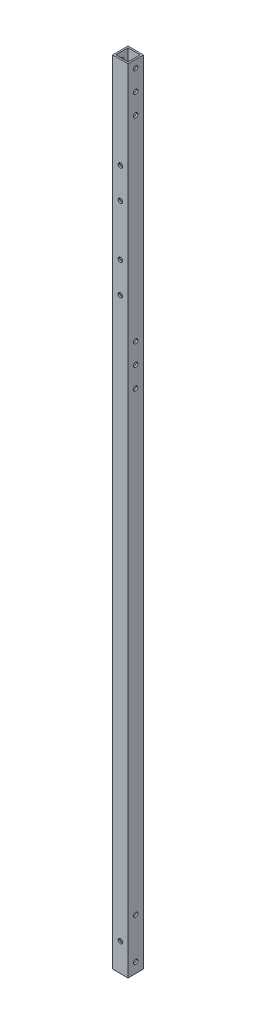
from build123d import *

# Parameters (mm, degrees)
SKETCH_1_W          = 15
SKETCH_1_H          = 15
SKETCH_1_W_2        = 12
SKETCH_1_H_2        = 12
EXTRUDE_1_DEPTH     = 775
CUT_EXTRUDE_1_REACH = 777.29
SKETCH_2_R          = 2.15
CUT_EXTRUDE_2_REACH = 777.29
SKETCH_3_R          = 2.15


with BuildPart() as part:
    # ｽｹｯﾁ1 → 押し出し-薄板1 (new body)
    with BuildSketch(Plane(origin=(0, 0, 0), x_dir=(1, 0, 0), z_dir=(0, 1, 0))):
        with Locations((7.5, 7.5)):
            Rectangle(SKETCH_1_W, SKETCH_1_H)
        with Locations((7.5, 7.5)):
            Rectangle(SKETCH_1_W_2, SKETCH_1_H_2, mode=Mode.SUBTRACT)
    extrude(amount=EXTRUDE_1_DEPTH)

    # ｶｯﾄ - 押し出し1: up to this face of the body (flat: up to its plane)
    cut_extrude_1_end = Plane(part.part.faces().sort_by_distance((0, 387.5, -7.5))[0])
    # ｽｹｯﾁ2 → ｶｯﾄ - 押し出し1 (cut, up to the picked face)
    with BuildSketch(Plane(origin=(15, 0, 0), x_dir=(0, 0, -1), z_dir=(1, 0, 0)), mode=Mode.PRIVATE) as cut_extrude_1_sk1:
        with Locations((7.5, 10)):
            Circle(SKETCH_2_R)
    cut_extrude_1_tool1 = split(extrude(cut_extrude_1_sk1.sketch, amount=-CUT_EXTRUDE_1_REACH, mode=Mode.PRIVATE), bisect_by=cut_extrude_1_end, keep=Keep.BOTH, mode=Mode.PRIVATE)
    # ｽｹｯﾁ2 → ｶｯﾄ - 押し出し1 (cut, up to the picked face)
    with BuildSketch(Plane(origin=(15, 0, 0), x_dir=(0, 0, -1), z_dir=(1, 0, 0)), mode=Mode.PRIVATE) as cut_extrude_1_sk2:
        with Locations((7.5, 516)):
            Circle(SKETCH_2_R)
    cut_extrude_1_tool2 = split(extrude(cut_extrude_1_sk2.sketch, amount=-CUT_EXTRUDE_1_REACH, mode=Mode.PRIVATE), bisect_by=cut_extrude_1_end, keep=Keep.BOTH, mode=Mode.PRIVATE)
    # ｽｹｯﾁ2 → ｶｯﾄ - 押し出し1 (cut, up to the picked face)
    with BuildSketch(Plane(origin=(15, 0, 0), x_dir=(0, 0, -1), z_dir=(1, 0, 0)), mode=Mode.PRIVATE) as cut_extrude_1_sk3:
        with Locations((7.5, 767.5)):
            Circle(SKETCH_2_R)
    cut_extrude_1_tool3 = split(extrude(cut_extrude_1_sk3.sketch, amount=-CUT_EXTRUDE_1_REACH, mode=Mode.PRIVATE), bisect_by=cut_extrude_1_end, keep=Keep.BOTH, mode=Mode.PRIVATE)
    # ｽｹｯﾁ2 → ｶｯﾄ - 押し出し1 (cut, up to the picked face)
    with BuildSketch(Plane(origin=(15, 0, 0), x_dir=(0, 0, -1), z_dir=(1, 0, 0)), mode=Mode.PRIVATE) as cut_extrude_1_sk4:
        with Locations((7.5, 50)):
            Circle(SKETCH_2_R)
    cut_extrude_1_tool4 = split(extrude(cut_extrude_1_sk4.sketch, amount=-CUT_EXTRUDE_1_REACH, mode=Mode.PRIVATE), bisect_by=cut_extrude_1_end, keep=Keep.BOTH, mode=Mode.PRIVATE)
    # ｽｹｯﾁ2 → ｶｯﾄ - 押し出し1 (cut, up to the picked face)
    with BuildSketch(Plane(origin=(15, 0, 0), x_dir=(0, 0, -1), z_dir=(1, 0, 0)), mode=Mode.PRIVATE) as cut_extrude_1_sk5:
        with Locations((7.5, 536)):
            Circle(SKETCH_2_R)
    cut_extrude_1_tool5 = split(extrude(cut_extrude_1_sk5.sketch, amount=-CUT_EXTRUDE_1_REACH, mode=Mode.PRIVATE), bisect_by=cut_extrude_1_end, keep=Keep.BOTH, mode=Mode.PRIVATE)
    # ｽｹｯﾁ2 → ｶｯﾄ - 押し出し1 (cut, up to the picked face)
    with BuildSketch(Plane(origin=(15, 0, 0), x_dir=(0, 0, -1), z_dir=(1, 0, 0)), mode=Mode.PRIVATE) as cut_extrude_1_sk6:
        with Locations(Location((7.5, 496, 0), (0, 0, 180))):
            Circle(SKETCH_2_R)
    cut_extrude_1_tool6 = split(extrude(cut_extrude_1_sk6.sketch, amount=-CUT_EXTRUDE_1_REACH, mode=Mode.PRIVATE), bisect_by=cut_extrude_1_end, keep=Keep.BOTH, mode=Mode.PRIVATE)
    # ｽｹｯﾁ2 → ｶｯﾄ - 押し出し1 (cut, up to the picked face)
    with BuildSketch(Plane(origin=(15, 0, 0), x_dir=(0, 0, -1), z_dir=(1, 0, 0)), mode=Mode.PRIVATE) as cut_extrude_1_sk7:
        with Locations((7.5, 747.5)):
            Circle(SKETCH_2_R)
    cut_extrude_1_tool7 = split(extrude(cut_extrude_1_sk7.sketch, amount=-CUT_EXTRUDE_1_REACH, mode=Mode.PRIVATE), bisect_by=cut_extrude_1_end, keep=Keep.BOTH, mode=Mode.PRIVATE)
    # ｽｹｯﾁ2 → ｶｯﾄ - 押し出し1 (cut, up to the picked face)
    with BuildSketch(Plane(origin=(15, 0, 0), x_dir=(0, 0, -1), z_dir=(1, 0, 0)), mode=Mode.PRIVATE) as cut_extrude_1_sk8:
        with Locations((7.5, 727.5)):
            Circle(SKETCH_2_R)
    cut_extrude_1_tool8 = split(extrude(cut_extrude_1_sk8.sketch, amount=-CUT_EXTRUDE_1_REACH, mode=Mode.PRIVATE), bisect_by=cut_extrude_1_end, keep=Keep.BOTH, mode=Mode.PRIVATE)
    add(cut_extrude_1_tool1.solids().sort_by(Axis((15, 10, -7.5), (-1, 0, 0)))[0], mode=Mode.SUBTRACT)
    add(cut_extrude_1_tool2.solids().sort_by(Axis((15, 516, -7.5), (-1, 0, 0)))[0], mode=Mode.SUBTRACT)
    add(cut_extrude_1_tool3.solids().sort_by(Axis((15, 767.5, -7.5), (-1, 0, 0)))[0], mode=Mode.SUBTRACT)
    add(cut_extrude_1_tool4.solids().sort_by(Axis((15, 50, -7.5), (-1, 0, 0)))[0], mode=Mode.SUBTRACT)
    add(cut_extrude_1_tool5.solids().sort_by(Axis((15, 536, -7.5), (-1, 0, 0)))[0], mode=Mode.SUBTRACT)
    add(cut_extrude_1_tool6.solids().sort_by(Axis((15, 496, -7.5), (-1, 0, 0)))[0], mode=Mode.SUBTRACT)
    add(cut_extrude_1_tool7.solids().sort_by(Axis((15, 747.5, -7.5), (-1, 0, 0)))[0], mode=Mode.SUBTRACT)
    add(cut_extrude_1_tool8.solids().sort_by(Axis((15, 727.5, -7.5), (-1, 0, 0)))[0], mode=Mode.SUBTRACT)

    # ｶｯﾄ - 押し出し2: up to this face of the body (flat: up to its plane)
    cut_extrude_2_end = Plane(part.part.faces().sort_by_distance((7.5, 387.5, -15))[0])
    # ｽｹｯﾁ3 → ｶｯﾄ - 押し出し2 (cut, up to the picked face)
    with BuildSketch(Plane.XY, mode=Mode.PRIVATE) as cut_extrude_2_sk1:
        with Locations((7.5, 685)):
            Circle(SKETCH_3_R)
    cut_extrude_2_tool1 = split(extrude(cut_extrude_2_sk1.sketch, amount=-CUT_EXTRUDE_2_REACH, mode=Mode.PRIVATE), bisect_by=cut_extrude_2_end, keep=Keep.BOTH, mode=Mode.PRIVATE)
    # ｽｹｯﾁ3 → ｶｯﾄ - 押し出し2 (cut, up to the picked face)
    with BuildSketch(Plane.XY, mode=Mode.PRIVATE) as cut_extrude_2_sk2:
        with Locations((7.5, 655)):
            Circle(SKETCH_3_R)
    cut_extrude_2_tool2 = split(extrude(cut_extrude_2_sk2.sketch, amount=-CUT_EXTRUDE_2_REACH, mode=Mode.PRIVATE), bisect_by=cut_extrude_2_end, keep=Keep.BOTH, mode=Mode.PRIVATE)
    # ｽｹｯﾁ3 → ｶｯﾄ - 押し出し2 (cut, up to the picked face)
    with BuildSketch(Plane.XY, mode=Mode.PRIVATE) as cut_extrude_2_sk3:
        with Locations((7.5, 605)):
            Circle(SKETCH_3_R)
    cut_extrude_2_tool3 = split(extrude(cut_extrude_2_sk3.sketch, amount=-CUT_EXTRUDE_2_REACH, mode=Mode.PRIVATE), bisect_by=cut_extrude_2_end, keep=Keep.BOTH, mode=Mode.PRIVATE)
    # ｽｹｯﾁ3 → ｶｯﾄ - 押し出し2 (cut, up to the picked face)
    with BuildSketch(Plane.XY, mode=Mode.PRIVATE) as cut_extrude_2_sk4:
        with Locations((7.5, 575)):
            Circle(SKETCH_3_R)
    cut_extrude_2_tool4 = split(extrude(cut_extrude_2_sk4.sketch, amount=-CUT_EXTRUDE_2_REACH, mode=Mode.PRIVATE), bisect_by=cut_extrude_2_end, keep=Keep.BOTH, mode=Mode.PRIVATE)
    # ｽｹｯﾁ3 → ｶｯﾄ - 押し出し2 (cut, up to the picked face)
    with BuildSketch(Plane.XY, mode=Mode.PRIVATE) as cut_extrude_2_sk5:
        with Locations((7.5, 27.5)):
            Circle(SKETCH_3_R)
    cut_extrude_2_tool5 = split(extrude(cut_extrude_2_sk5.sketch, amount=-CUT_EXTRUDE_2_REACH, mode=Mode.PRIVATE), bisect_by=cut_extrude_2_end, keep=Keep.BOTH, mode=Mode.PRIVATE)
    add(cut_extrude_2_tool1.solids().sort_by(Axis((7.5, 685, 0), (0, 0, -1)))[0], mode=Mode.SUBTRACT)
    add(cut_extrude_2_tool2.solids().sort_by(Axis((7.5, 655, 0), (0, 0, -1)))[0], mode=Mode.SUBTRACT)
    add(cut_extrude_2_tool3.solids().sort_by(Axis((7.5, 605, 0), (0, 0, -1)))[0], mode=Mode.SUBTRACT)
    add(cut_extrude_2_tool4.solids().sort_by(Axis((7.5, 575, 0), (0, 0, -1)))[0], mode=Mode.SUBTRACT)
    add(cut_extrude_2_tool5.solids().sort_by(Axis((7.5, 27.5, 0), (0, 0, -1)))[0], mode=Mode.SUBTRACT)


solid = part.part
